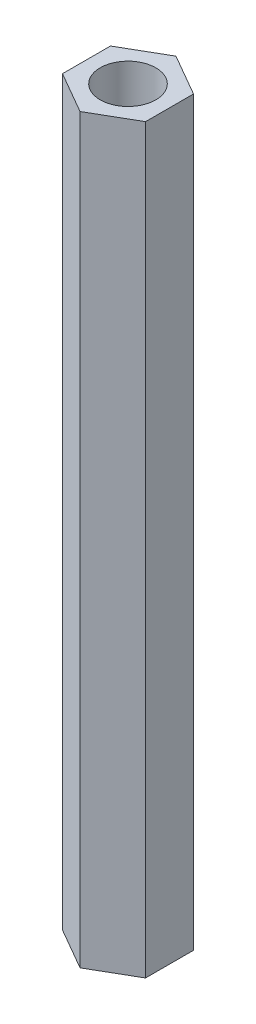
from build123d import *

# Parameters (mm, degrees)
SKETCH1_R           = 1.190625
BOSS_EXTRUDE1_DEPTH = 31.75


with BuildPart() as part:
    # Sketch1 → Boss-Extrude1 (new body)
    with BuildSketch(Plane(origin=(0, 0, 0), x_dir=(1, 0, 0), z_dir=(0, 1, 0))):
        Polygon((0, -2.053057557), (1.778, -1.026528779), (1.778, 1.026528779), (0, 2.053057557), (-1.778, 1.026528779), (-1.778, -1.026528779), align=None)
        with Locations(Location((0, 0, 0), (0, 0, 270))):
            Circle(SKETCH1_R, mode=Mode.SUBTRACT)
    extrude(amount=BOSS_EXTRUDE1_DEPTH)


solid = part.part
